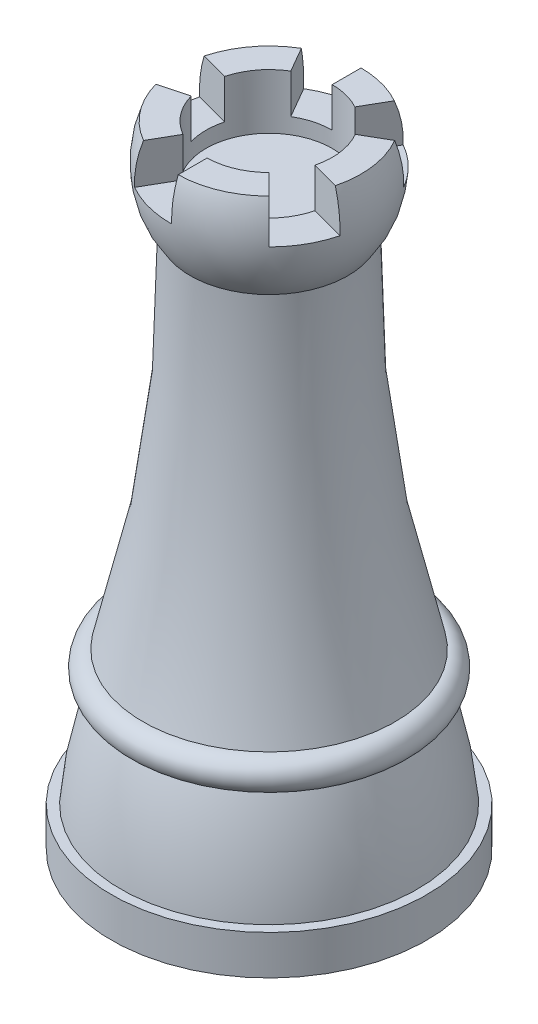
from build123d import *

# Parameters (mm, degrees)
SKETCH2_R          = 5.08
CUT_EXTRUDE1_DEPTH = 4.445
CUT_EXTRUDE2_DEPTH = 3.175
CIRPATTERN1_COUNT  = 5
CIRPATTERN1_ANGLE  = 300


with BuildPart() as part:
    # Sketch1 → Revolve1 (revolve)
    with BuildSketch(Plane.XY, mode=Mode.PRIVATE) as revolve1_sk:
        with BuildLine():
            Line((0, 0), (12.7, 0))
            Line((12.7, 0), (12.7, 3.175))
            Line((12.7, 3.175), (11.938, 3.175))
            ThreePointArc((11.938, 3.175), (11.324664102, 7.361873807), (10.16, 11.43))
            ThreePointArc((10.16, 11.43), (11.43, 12.7), (10.16, 13.97))
            ThreePointArc((10.16, 13.97), (7.163161242, 28.432586249), (6.35, 43.18))
            ThreePointArc((6.35, 43.18), (7.862457045, 46.853612737), (7.405308906, 50.8))
            Line((7.405308906, 50.8), (0, 50.8))
            Line((0, 50.8), (0, 0))
        make_face()
    revolve(revolve1_sk.sketch.rotate(Axis((0, 0, 0), (0, 1, 0)), 90), axis=Axis((0, 0, 0), (0, 1, 0)))

    # Sketch2 → Cut-Extrude1 (cut)
    with BuildSketch(Plane(origin=(0, 50.8, 0), x_dir=(1, 0, 0), z_dir=(0, 1, 0))):
        with Locations(Location((0, 0, 0), (0, 0, 270))):
            Circle(SKETCH2_R)
    extrude(amount=-CUT_EXTRUDE1_DEPTH, mode=Mode.SUBTRACT)

    # Sketch3 → Cut-Extrude2 (cut)
    with BuildSketch(Plane(origin=(0, 50.8, 0), x_dir=(1, 0, 0), z_dir=(0, 1, 0))):
        with BuildLine():
            Line((0, 10.16), (0, 5.08))
            ThreePointArc((0, 5.08), (-1.354819608, 4.896004885), (-2.611497409, 4.357347965))
            Line((-2.611497409, 4.357347965), (-5.070044486, 8.615676415))
            ThreePointArc((-5.070044486, 8.615676415), (-2.637496551, 9.724263362), (0, 10.16))
        make_face()
    cut_extrude2 = extrude(amount=-CUT_EXTRUDE2_DEPTH, mode=Mode.SUBTRACT)

    # CirPattern1: Cut-Extrude2 ×5 about axis
    cirpattern1_axis = Axis((0, 0, 0), (0, 1, 0))
    for i in range(1, CIRPATTERN1_COUNT):
        add(cut_extrude2.rotate(cirpattern1_axis, i * CIRPATTERN1_ANGLE / (CIRPATTERN1_COUNT - 1)), mode=Mode.SUBTRACT)


solid = part.part
